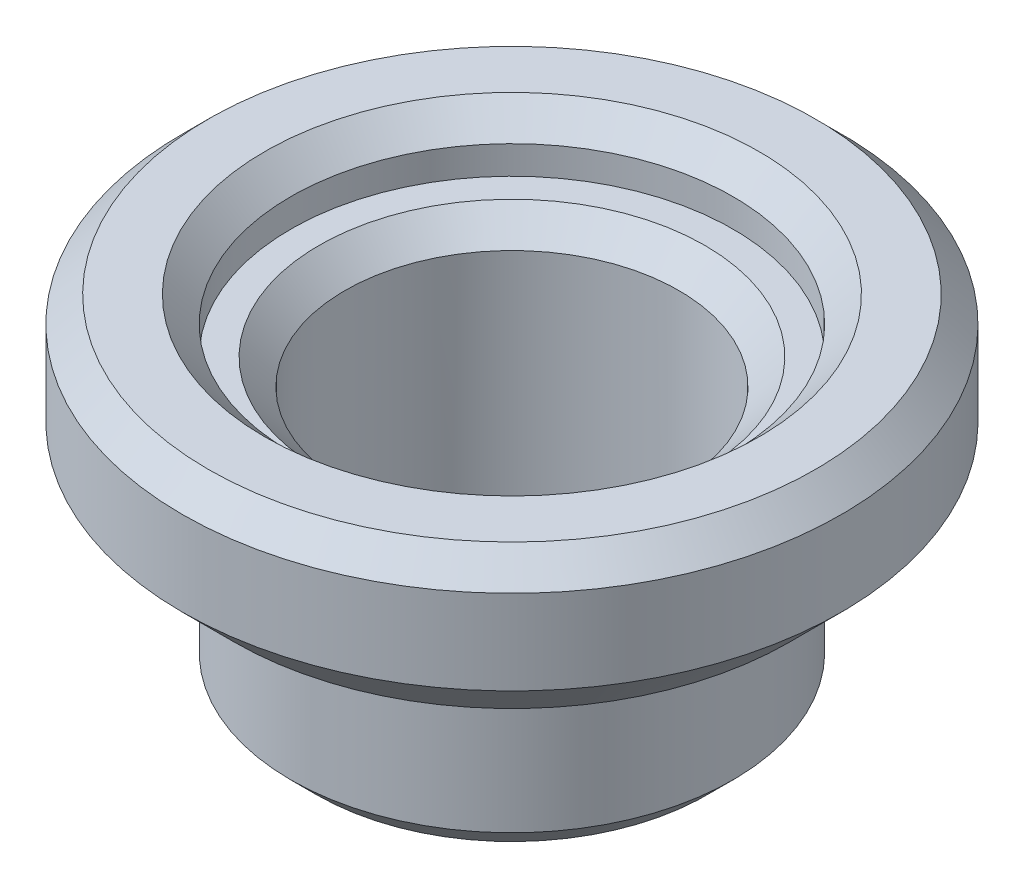
from build123d import *

# Parameters (mm, degrees)
SKETCH1_R           = 9.652
SKETCH1_R_2         = 6.477
BOSS_EXTRUDE1_DEPTH = 3.175
BOSS_EXTRUDE2_START = 3.175
SKETCH1_3_R         = 9.652
SKETCH1_3_R_2       = 6.477
BOSS_EXTRUDE2_DEPTH = 1.5875
BOSS_EXTRUDE3_START = 5.08
SKETCH2_R           = 6.477
SKETCH2_R_2         = 4.8895
BOSS_EXTRUDE3_DEPTH = 5.08
SKETCH3_R           = 4.8895
CUT_EXTRUDE1_DEPTH  = 15.564635526
CHAMFER1_SIZE       = 1.524
CHAMFER2_SIZE       = 0.762
CHAMFER3_SIZE       = 0.762


with BuildPart() as part:
    # Sketch1 → Boss-Extrude1 (new body)
    # profile 1 of 2: a face of its own
    with BuildSketch(Plane(origin=(0, 0, 0), x_dir=(1, 0, 0), z_dir=(0, 1, 0))):
        with Locations(Location((0, 0, 0), (0, 0, 270))):
            Circle(SKETCH1_R)
        Circle(SKETCH1_R_2, mode=Mode.SUBTRACT)
    # profile 2 of 2: a face of its own
    with BuildSketch(Plane(origin=(0, 0, 0), x_dir=(1, 0, 0), z_dir=(0, 1, 0))):
        Circle(SKETCH1_R_2)
    extrude(amount=BOSS_EXTRUDE1_DEPTH)

    # Sketch1<3> → Boss-Extrude2 (add)
    with BuildSketch(Plane(origin=(0, 0, 0), x_dir=(1, 0, 0), z_dir=(0, 1, 0)).offset(BOSS_EXTRUDE2_START)):
        with Locations(Location((0, 0, 0), (0, 0, 270))):
            Circle(SKETCH1_3_R)
        with Locations(Location((0, 0, 0), (0, 0, 270))):
            Circle(SKETCH1_3_R_2, mode=Mode.SUBTRACT)
    extrude(amount=BOSS_EXTRUDE2_DEPTH)

    # Sketch2 → Boss-Extrude3 (add)
    with BuildSketch(Plane.XZ.offset(BOSS_EXTRUDE3_START)):
        with Locations(Location((0, 0, 0), (0, 0, 90))):
            Circle(SKETCH2_R)
        with Locations(Location((0, 0, 0), (0, 0, 270))):
            Circle(SKETCH2_R_2, mode=Mode.SUBTRACT)
    extrude(amount=-BOSS_EXTRUDE3_DEPTH)

    # Sketch3 → Cut-Extrude1 (cut, through all)
    with BuildSketch(Plane.XZ):
        with Locations(Location((0, 0, 0), (0, 0, 90))):
            Circle(SKETCH3_R)
    extrude(amount=-CUT_EXTRUDE1_DEPTH, mode=Mode.SUBTRACT)

    # Chamfer1
    chamfer1_edges = [part.edges().sort_by_distance(p)[0] for p in [
        (0, 0, -9.652),
    ]]
    chamfer(chamfer1_edges, length=CHAMFER1_SIZE)

    # Chamfer2
    chamfer2_edges = [part.edges().sort_by_distance(p)[0] for p in [
        (0, 3.175, -4.8895),
        (0, 4.7625, -9.652),
        (0, 4.7625, -6.477),
    ]]
    chamfer(chamfer2_edges, length=CHAMFER2_SIZE)

    # Chamfer3
    chamfer3_edges = [part.edges().sort_by_distance(p)[0] for p in [
        (0, -5.08, -6.477),
    ]]
    chamfer(chamfer3_edges, length=CHAMFER3_SIZE)


solid = part.part
